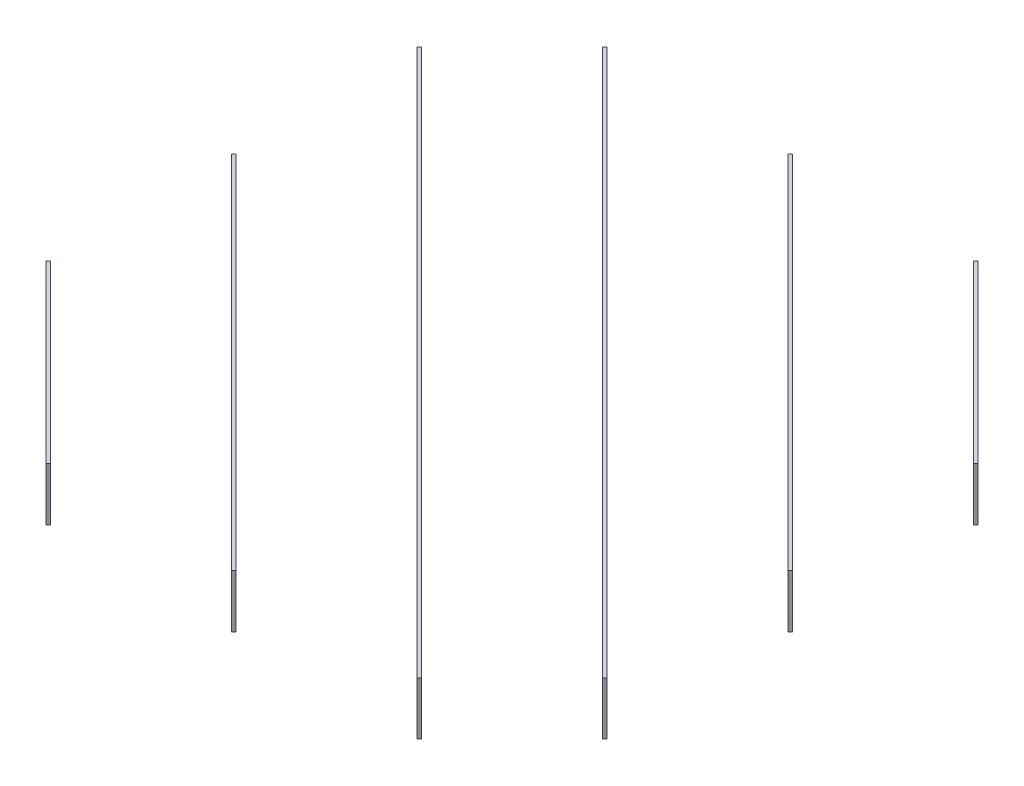
from build123d import *

# Parameters (mm, degrees)
BOSS_EXTRUDE1_DEPTH   = 100
BOSS_EXTRUDE1_2_DEPTH = 100
BOSS_EXTRUDE1_3_DEPTH = 100
BOSS_EXTRUDE1_4_DEPTH = 100
BOSS_EXTRUDE1_5_DEPTH = 100
BOSS_EXTRUDE1_6_DEPTH = 100
SKETCH3_R             = 1.5
SKETCH3_W             = 6
SKETCH3_H             = 100
CUT_EXTRUDE1_DEPTH    = 1481.698283187
SKETCH6_W             = 56
SKETCH6_H             = 12
CUT_EXTRUDE3_DEPTH    = 6
SKETCH7_W             = 56
SKETCH7_H             = 12
CUT_EXTRUDE4_DEPTH    = 6


with BuildPart() as part:
    # Sketch2 → Boss-Extrude1 (new body)
    with BuildSketch(Plane(origin=(0, 0, 0), x_dir=(1, 0, 0), z_dir=(0, 1, 0))):
        Polygon((-605, -274.242640687), (-274.242640687, -605), (-270, -600.757359313), (-600.757359313, -270), align=None)
    extrude(amount=BOSS_EXTRUDE1_DEPTH)


with BuildPart() as body_2:
    # Sketch2 → Boss-Extrude1 2 (new body)
    with BuildSketch(Plane(origin=(0, 0, 0), x_dir=(1, 0, 0), z_dir=(0, 1, 0))):
        Polygon((-605, 75.757359313), (75.757359313, -605), (80, -600.757359313), (-600.757359313, 80), align=None)
    extrude(amount=BOSS_EXTRUDE1_2_DEPTH)


with BuildPart() as body_3:
    # Sketch2 → Boss-Extrude1 3 (new body)
    with BuildSketch(Plane(origin=(0, 0, 0), x_dir=(1, 0, 0), z_dir=(0, 1, 0))):
        Polygon((-605, 425.757359313), (425.757359313, -605), (430, -600.757359313), (-600.757359313, 430), align=None)
    extrude(amount=BOSS_EXTRUDE1_3_DEPTH)


with BuildPart() as body_4:
    # Sketch2 → Boss-Extrude1 4 (new body)
    with BuildSketch(Plane(origin=(0, 0, 0), x_dir=(1, 0, 0), z_dir=(0, 1, 0))):
        Polygon((-430, 600.757359313), (600.757359313, -430), (605, -425.757359313), (-425.757359313, 605), align=None)
    extrude(amount=BOSS_EXTRUDE1_4_DEPTH)


with BuildPart() as body_5:
    # Sketch2 → Boss-Extrude1 5 (new body)
    with BuildSketch(Plane(origin=(0, 0, 0), x_dir=(1, 0, 0), z_dir=(0, 1, 0))):
        Polygon((-80, 600.757359313), (600.757359313, -80), (605, -75.757359313), (-75.757359313, 605), align=None)
    extrude(amount=BOSS_EXTRUDE1_5_DEPTH)


with BuildPart() as body_6:
    # Sketch2 → Boss-Extrude1 6 (new body)
    with BuildSketch(Plane(origin=(0, 0, 0), x_dir=(1, 0, 0), z_dir=(0, 1, 0))):
        Polygon((270, 600.757359313), (600.757359313, 270), (605, 274.242640687), (274.242640687, 605), align=None)
    extrude(amount=BOSS_EXTRUDE1_6_DEPTH)


with BuildPart() as cut_extrude1_tool:
    # Sketch3 → Cut-Extrude1 (new, through all)
    with BuildSketch(Plane(origin=(-439.621320344, 0, 439.621320344), x_dir=(0.7071067811865451, 0, 0.70710678118655), z_dir=(-0.70710678118655, 0, 0.7071067811865451))):
        with Locations((-615.718433538, 50)):
            Circle(SKETCH3_R)
        with Locations((-621.718433538, 50)):
            Circle(SKETCH3_R)
        with Locations((-618.718433538, 0)):
            Rectangle(SKETCH3_W, SKETCH3_H)
        with BuildLine():
            Line((-621.718433538, 48.5), (-621.718433538, 50))
            Line((-621.718433538, 50), (-620.218433538, 50))
            ThreePointArc((-620.218433538, 50), (-622.77909371, 51.060660172), (-621.718433538, 48.5))
        make_face()
        with BuildLine():
            Line((-620.218433538, 50), (-621.718433538, 50))
            Line((-621.718433538, 50), (-621.718433538, 48.5))
            ThreePointArc((-621.718433538, 48.5), (-620.657773366, 48.939339828), (-620.218433538, 50))
        make_face()
        with BuildLine():
            ThreePointArc((-614.218433538, 50), (-615.718433538, 51.5), (-617.218433538, 50))
            Line((-617.218433538, 50), (-615.718433538, 50))
            Line((-615.718433538, 50), (-615.718433538, 48.5))
            ThreePointArc((-615.718433538, 48.5), (-614.657773366, 48.939339828), (-614.218433538, 50))
        make_face()
        with BuildLine():
            Line((-615.718433538, 50), (-617.218433538, 50))
            ThreePointArc((-617.218433538, 50), (-616.77909371, 48.939339828), (-615.718433538, 48.5))
            Line((-615.718433538, 48.5), (-615.718433538, 50))
        make_face()
        with BuildLine():
            Line((-374.231060123, 48.5), (-374.231060123, 50))
            Line((-374.231060123, 50), (-372.731060123, 50))
            ThreePointArc((-372.731060123, 50), (-375.291720295, 51.060660172), (-374.231060123, 48.5))
        make_face()
        with BuildLine():
            Line((-372.731060123, 50), (-374.231060123, 50))
            Line((-374.231060123, 50), (-374.231060123, 48.5))
            ThreePointArc((-374.231060123, 48.5), (-373.170399951, 48.939339828), (-372.731060123, 50))
        make_face()
        with Locations((-368.231060123, 50)):
            Circle(SKETCH3_R)
        with Locations((-374.231060123, 50)):
            Circle(SKETCH3_R)
        with Locations((-371.231060123, 0)):
            Rectangle(SKETCH3_W, SKETCH3_H)
        with BuildLine():
            ThreePointArc((-366.731060123, 50), (-368.231060123, 51.5), (-369.731060123, 50))
            Line((-369.731060123, 50), (-368.231060123, 50))
            Line((-368.231060123, 50), (-368.231060123, 48.5))
            ThreePointArc((-368.231060123, 48.5), (-367.170399951, 48.939339828), (-366.731060123, 50))
        make_face()
        with BuildLine():
            Line((-368.231060123, 50), (-369.731060123, 50))
            ThreePointArc((-369.731060123, 50), (-369.291720295, 48.939339828), (-368.231060123, 48.5))
            Line((-368.231060123, 48.5), (-368.231060123, 50))
        make_face()
        with BuildLine():
            Line((-126.705577884, 48.5), (-126.705577884, 50))
            Line((-126.705577884, 50), (-125.205577884, 50))
            ThreePointArc((-125.205577884, 50), (-127.766238056, 51.060660172), (-126.705577884, 48.5))
        make_face()
        with BuildLine():
            Line((-125.205577884, 50), (-126.705577884, 50))
            Line((-126.705577884, 50), (-126.705577884, 48.5))
            ThreePointArc((-126.705577884, 48.5), (-125.644917713, 48.939339828), (-125.205577884, 50))
        make_face()
        with BuildLine():
            ThreePointArc((-119.205577884, 50), (-120.705577884, 51.5), (-122.205577884, 50))
            Line((-122.205577884, 50), (-120.705577884, 50))
            Line((-120.705577884, 50), (-120.705577884, 48.5))
            ThreePointArc((-120.705577884, 48.5), (-119.644917713, 48.939339828), (-119.205577884, 50))
        make_face()
        with BuildLine():
            Line((-120.705577884, 50), (-122.205577884, 50))
            ThreePointArc((-122.205577884, 50), (-121.766238056, 48.939339828), (-120.705577884, 48.5))
            Line((-120.705577884, 48.5), (-120.705577884, 50))
        make_face()
        with BuildLine():
            Line((-122.205577884, 50), (-125.205577884, 50))
            ThreePointArc((-125.205577884, 50), (-125.644917713, 48.939339828), (-126.705577884, 48.5))
            Line((-126.705577884, 48.5), (-126.705577884, 0))
            Line((-126.705577884, 0), (-120.705577884, 0))
            Line((-120.705577884, 0), (-120.705577884, 48.5))
            ThreePointArc((-120.705577884, 48.5), (-121.766238056, 48.939339828), (-122.205577884, 50))
        make_face()
        with BuildLine():
            ThreePointArc((122.205577884, 50), (119.644917713, 51.060660172), (120.705577884, 48.5))
            Line((120.705577884, 48.5), (120.705577884, 50))
            Line((120.705577884, 50), (122.205577884, 50))
        make_face()
        with BuildLine():
            Line((120.705577884, 50), (120.705577884, 48.5))
            ThreePointArc((120.705577884, 48.5), (121.766238056, 48.939339828), (122.205577884, 50))
            Line((122.205577884, 50), (120.705577884, 50))
        make_face()
        with BuildLine():
            Line((120.705577884, 48.5), (120.705577884, 0))
            Line((120.705577884, 0), (126.705577884, 0))
            Line((126.705577884, 0), (126.705577884, 48.5))
            ThreePointArc((126.705577884, 48.5), (125.644917713, 48.939339828), (125.205577884, 50))
            Line((125.205577884, 50), (122.205577884, 50))
            ThreePointArc((122.205577884, 50), (121.766238056, 48.939339828), (120.705577884, 48.5))
        make_face()
        with BuildLine():
            ThreePointArc((125.205577884, 50), (125.644917713, 48.939339828), (126.705577884, 48.5))
            Line((126.705577884, 48.5), (126.705577884, 50))
            Line((126.705577884, 50), (125.205577884, 50))
        make_face()
        with BuildLine():
            Line((126.705577884, 50), (126.705577884, 48.5))
            ThreePointArc((126.705577884, 48.5), (127.766238056, 48.939339828), (128.205577884, 50))
            ThreePointArc((128.205577884, 50), (126.705577884, 51.5), (125.205577884, 50))
            Line((125.205577884, 50), (126.705577884, 50))
        make_face()
        with BuildLine():
            Line((369.731060123, 50), (368.231060123, 50))
            Line((368.231060123, 50), (368.231060123, 48.5))
            ThreePointArc((368.231060123, 48.5), (369.291720295, 48.939339828), (369.731060123, 50))
        make_face()
        with BuildLine():
            Line((368.231060123, 48.5), (368.231060123, 50))
            Line((368.231060123, 50), (369.731060123, 50))
            ThreePointArc((369.731060123, 50), (367.170399951, 51.060660172), (368.231060123, 48.5))
        make_face()
        with Locations((374.231060123, 50)):
            Circle(SKETCH3_R)
        with Locations((368.231060123, 50)):
            Circle(SKETCH3_R)
        with Locations((371.231060123, 0)):
            Rectangle(SKETCH3_W, SKETCH3_H)
        with BuildLine():
            ThreePointArc((375.731060123, 50), (374.231060123, 51.5), (372.731060123, 50))
            Line((372.731060123, 50), (374.231060123, 50))
            Line((374.231060123, 50), (374.231060123, 48.5))
            ThreePointArc((374.231060123, 48.5), (375.291720295, 48.939339828), (375.731060123, 50))
        make_face()
        with BuildLine():
            Line((374.231060123, 50), (372.731060123, 50))
            ThreePointArc((372.731060123, 50), (373.170399951, 48.939339828), (374.231060123, 48.5))
            Line((374.231060123, 48.5), (374.231060123, 50))
        make_face()
        with BuildLine():
            Line((617.218433538, 50), (615.718433538, 50))
            Line((615.718433538, 50), (615.718433538, 48.5))
            ThreePointArc((615.718433538, 48.5), (616.77909371, 48.939339828), (617.218433538, 50))
        make_face()
        with BuildLine():
            Line((615.718433538, 48.5), (615.718433538, 50))
            Line((615.718433538, 50), (617.218433538, 50))
            ThreePointArc((617.218433538, 50), (614.657773366, 51.060660172), (615.718433538, 48.5))
        make_face()
        with BuildLine():
            ThreePointArc((623.218433538, 50), (621.718433538, 51.5), (620.218433538, 50))
            Line((620.218433538, 50), (621.718433538, 50))
            Line((621.718433538, 50), (621.718433538, 48.5))
            ThreePointArc((621.718433538, 48.5), (622.77909371, 48.939339828), (623.218433538, 50))
        make_face()
        with BuildLine():
            Line((621.718433538, 50), (620.218433538, 50))
            ThreePointArc((620.218433538, 50), (620.657773366, 48.939339828), (621.718433538, 48.5))
            Line((621.718433538, 48.5), (621.718433538, 50))
        make_face()
        with Locations((621.718433538, 50)):
            Circle(SKETCH3_R)
        with Locations((615.718433538, 50)):
            Circle(SKETCH3_R)
        with Locations((618.718433538, 0)):
            Rectangle(SKETCH3_W, SKETCH3_H)
    extrude(amount=-CUT_EXTRUDE1_DEPTH)


with BuildPart() as part_1:
    add(part.part)

    # Cut-Extrude1: cut by cut_extrude1_tool
    add(cut_extrude1_tool.part, mode=Mode.SUBTRACT)


with BuildPart() as body_2_1:
    add(body_2.part)

    # Cut-Extrude1: cut by cut_extrude1_tool
    add(cut_extrude1_tool.part, mode=Mode.SUBTRACT)

    # Sketch7 → Cut-Extrude4 (cut)
    with BuildSketch(Plane(origin=(-264.621320344, 0, 264.621320344), x_dir=(0.7071067811865479, 0, 0.7071067811865472), z_dir=(-0.7071067811865472, 0, 0.7071067811865479))):
        with Locations((-0.019054412, 78)):
            Rectangle(SKETCH7_W, SKETCH7_H)
    extrude(amount=-CUT_EXTRUDE4_DEPTH, mode=Mode.SUBTRACT)


with BuildPart() as body_3_1:
    add(body_3.part)

    # Cut-Extrude1: cut by cut_extrude1_tool
    add(cut_extrude1_tool.part, mode=Mode.SUBTRACT)


with BuildPart() as body_4_1:
    add(body_4.part)

    # Cut-Extrude1: cut by cut_extrude1_tool
    add(cut_extrude1_tool.part, mode=Mode.SUBTRACT)


with BuildPart() as body_5_1:
    add(body_5.part)

    # Cut-Extrude1: cut by cut_extrude1_tool
    add(cut_extrude1_tool.part, mode=Mode.SUBTRACT)

    # Sketch6 → Cut-Extrude3 (cut)
    with BuildSketch(Plane(origin=(260.378679656, 0, -260.378679656), x_dir=(0.7071067811865479, 0, 0.7071067811865472), z_dir=(-0.7071067811865472, 0, 0.7071067811865479))):
        with Locations((-0.019054412, 78)):
            Rectangle(SKETCH6_W, SKETCH6_H)
    extrude(amount=-CUT_EXTRUDE3_DEPTH, mode=Mode.SUBTRACT)


with BuildPart() as body_6_1:
    add(body_6.part)

    # Cut-Extrude1: cut by cut_extrude1_tool
    add(cut_extrude1_tool.part, mode=Mode.SUBTRACT)


solid = Compound([part_1.part, body_2_1.part, body_3_1.part, body_4_1.part, body_5_1.part, body_6_1.part])
